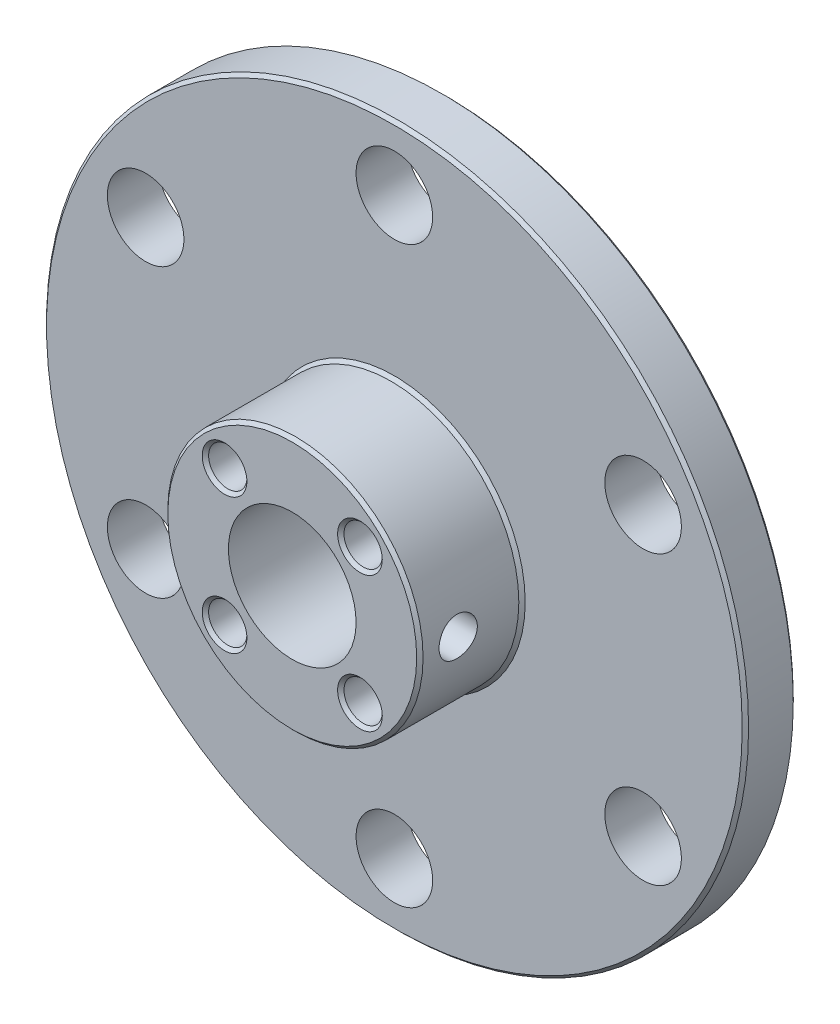
from build123d import *

# Parameters (mm, degrees)
SKETCH1_R           = 27.5
SKETCH1_R_2         = 3
BOSS_EXTRUDE1_DEPTH = 4
SKETCH2_R           = 10
BOSS_EXTRUDE2_DEPTH = 8
SKETCH3_R           = 15
BOSS_EXTRUDE3_DEPTH = 1.5
SKETCH4_R           = 1.5
CUT_EXTRUDE2_DEPTH  = 6
CUT_EXTRUDE3_START  = 10
SKETCH5_R           = 1.5
CUT_EXTRUDE3_DEPTH  = 3.5
SKETCH6_R           = 5
CUT_EXTRUDE4_DEPTH  = 10
SKETCH7_R           = 4
CUT_EXTRUDE5_DEPTH  = 42.167341458
CHAMFER1_SIZE       = 0.25
CHAMFER2_SIZE       = 0.25


with BuildPart() as part:
    # Sketch1 → Boss-Extrude1 (new body)
    with BuildSketch(Plane.XY):
        Circle(SKETCH1_R)
        with Locations((0, 22.5)):
            Circle(SKETCH1_R_2, mode=Mode.SUBTRACT)
        with Locations((19.485571585, 11.25)):
            Circle(SKETCH1_R_2, mode=Mode.SUBTRACT)
        with Locations((19.485571585, -11.25)):
            Circle(SKETCH1_R_2, mode=Mode.SUBTRACT)
        with Locations((0, -22.5)):
            Circle(SKETCH1_R_2, mode=Mode.SUBTRACT)
        with Locations((-19.485571585, -11.25)):
            Circle(SKETCH1_R_2, mode=Mode.SUBTRACT)
        with Locations((-19.485571585, 11.25)):
            Circle(SKETCH1_R_2, mode=Mode.SUBTRACT)
    extrude(amount=BOSS_EXTRUDE1_DEPTH)

    # Sketch2 → Boss-Extrude2 (add)
    with BuildSketch(Plane.XY.offset(4)):
        Circle(SKETCH2_R)
    extrude(amount=BOSS_EXTRUDE2_DEPTH)

    # Sketch3 → Boss-Extrude3 (add)
    with BuildSketch(Plane(origin=(0, 0, 0), x_dir=(-1, 0, 0), z_dir=(0, 0, -1))):
        with Locations(Location((0, 0, 0), (0, 0, 180))):
            Circle(SKETCH3_R)
    extrude(amount=BOSS_EXTRUDE3_DEPTH)

    # Sketch4 → Cut-Extrude2 (cut)
    with BuildSketch(Plane.XY.offset(12)):
        with Locations((-5.303300859, 5.303300859)):
            Circle(SKETCH4_R)
        with Locations((5.303300859, 5.303300859)):
            Circle(SKETCH4_R)
        with Locations((5.303300859, -5.303300859)):
            Circle(SKETCH4_R)
        with Locations((-5.303300859, -5.303300859)):
            Circle(SKETCH4_R)
    extrude(amount=-CUT_EXTRUDE2_DEPTH, mode=Mode.SUBTRACT)

    # Sketch5 → Cut-Extrude3 (cut)
    with BuildSketch(Plane(origin=(0, 0, 0), x_dir=(0, 0, -1), z_dir=(1, 0, 0)).offset(CUT_EXTRUDE3_START)):
        with Locations((-9, 0)):
            Circle(SKETCH5_R)
    cut_extrude3 = extrude(amount=-CUT_EXTRUDE3_DEPTH, mode=Mode.SUBTRACT)

    # Mirror1: Cut-Extrude3 across plane
    add(cut_extrude3.mirror(Plane(origin=(0, 0, 0), x_dir=(0, 0, 1), z_dir=(1, 0, 0))), mode=Mode.SUBTRACT)

    # Sketch6 → Cut-Extrude4 (cut)
    with BuildSketch(Plane.XY.offset(12)):
        Circle(SKETCH6_R)
    extrude(amount=-CUT_EXTRUDE4_DEPTH, mode=Mode.SUBTRACT)

    # Sketch7 → Cut-Extrude5 (cut, through all)
    with BuildSketch(Plane(origin=(0, 0, -1.5), x_dir=(-1, 0, 0), z_dir=(0, 0, -1))):
        Circle(SKETCH7_R)
    extrude(amount=-CUT_EXTRUDE5_DEPTH, mode=Mode.SUBTRACT)

    # Chamfer1
    chamfer1_edges = [part.edges().sort_by_distance(p)[0] for p in [
        (-6.803300859, -5.303300859, 12),
        (3.803300859, -5.303300859, 12),
        (3.803300859, 5.303300859, 12),
        (-6.803300859, 5.303300859, 12),
    ]]
    chamfer(chamfer1_edges, length=CHAMFER1_SIZE)

    # Chamfer2
    chamfer2_edges = [part.edges().sort_by_distance(p)[0] for p in [
        (-27.5, 0, 0),
        (-10, 0, 4),
        (-10, 0, 12),
        (-15, 0, 0),
        (-15, 0, -1.5),
        (-27.5, 0, 4),
    ]]
    chamfer(chamfer2_edges, length=CHAMFER2_SIZE)


solid = part.part
